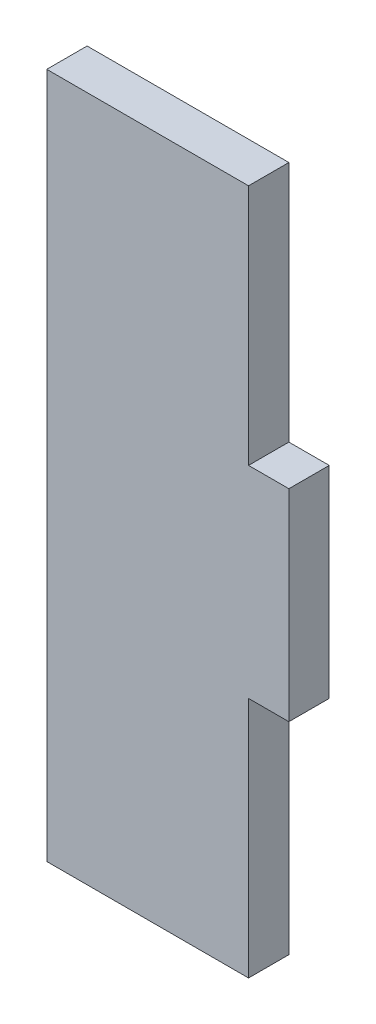
from build123d import *

# Parameters (mm, degrees)
BOSS_EXTRUDE1_DEPTH = 3


with BuildPart() as part:
    # Sketch1 → Boss-Extrude1 (new body)
    with BuildSketch(Plane.XY):
        Polygon((0, 0), (0, 51), (15, 51), (15, 33), (18, 33), (18, 18), (15, 18), (15, 0), align=None)
    extrude(amount=BOSS_EXTRUDE1_DEPTH)


solid = part.part
